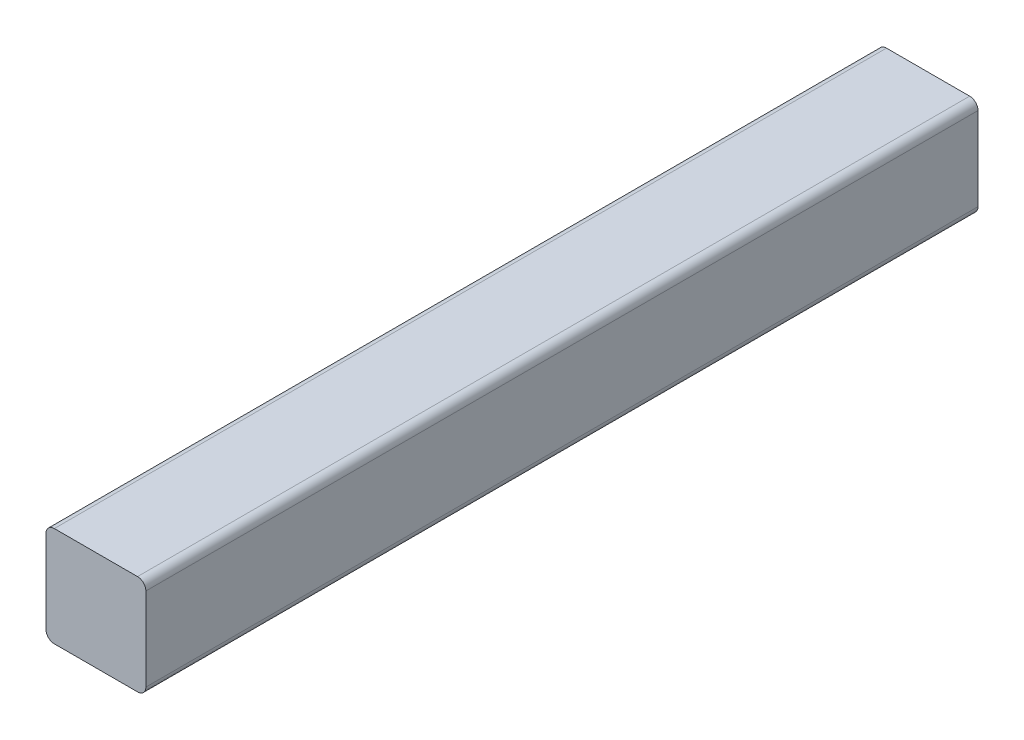
from build123d import *

# Parameters (mm, degrees)
SKETCH1_W           = 38.1
SKETCH1_H           = 38.1
BOSS_EXTRUDE1_DEPTH = 317.5
FILLET1_R           = 3.175


with BuildPart() as part:
    # Sketch1 → Boss-Extrude1 (new body)
    with BuildSketch(Plane.XY):
        Rectangle(SKETCH1_W, SKETCH1_H)
    extrude(amount=BOSS_EXTRUDE1_DEPTH)

    # Fillet1
    fillet1_edges = [part.edges().sort_by_distance(p)[0] for p in [
        (19.05, -19.05, 158.75),
        (-19.05, -19.05, 158.75),
        (-19.05, 19.05, 158.75),
        (19.05, 19.05, 158.75),
    ]]
    fillet(fillet1_edges, radius=FILLET1_R)


solid = part.part
